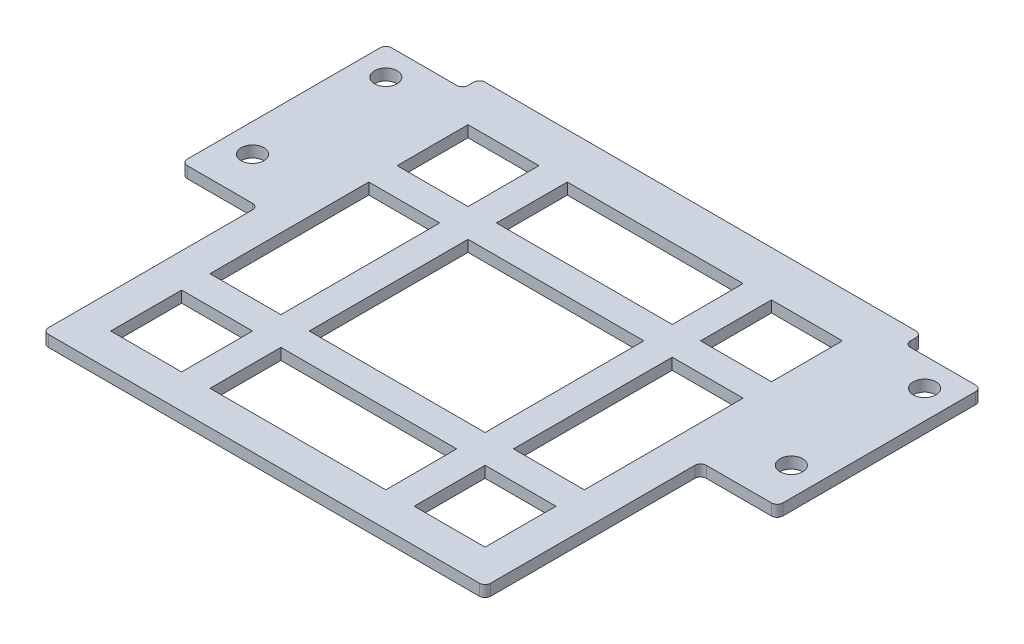
from build123d import *

# Parameters (mm, degrees)
SKETCH_1_R          = 2
EXTRUDE_1_DEPTH     = 2
SKETCH_3_W          = 66
SKETCH_3_H          = 63
CUT_EXTRUDE_1_DEPTH = 94.21614667
FILLET_1_R          = 1
SKETCH_4_W          = 66
SKETCH_4_H          = 5
SKETCH_4_W_2        = 5
SKETCH_4_H_2        = 63
EXTRUDE_1_2_DEPTH   = 2


with BuildPart() as part:
    # 草图1 → Extrude 1 (new body)
    with BuildSketch(Plane(origin=(0, 0, 0), x_dir=(1, 0, 0), z_dir=(0, 1, 0))):
        Polygon((-52.5, -39), (-52.5, -3), (-39, -3), (-39, 0), (39, 0), (39, -3), (52.5, -3), (52.5, -39), (39, -39), (39, -77), (-39, -77), (-39, -39), align=None)
        with Locations(Location((-47.5, -8, 0), (0, 0, 270))):
            Circle(SKETCH_1_R, mode=Mode.SUBTRACT)
        with Locations(Location((-47.5, -31.5, 0), (0, 0, 270))):
            Circle(SKETCH_1_R, mode=Mode.SUBTRACT)
        with Locations(Location((47.5, -31.5, 0), (0, 0, 90))):
            Circle(SKETCH_1_R, mode=Mode.SUBTRACT)
        with Locations(Location((47.5, -8, 0), (0, 0, 90))):
            Circle(SKETCH_1_R, mode=Mode.SUBTRACT)
    extrude(amount=EXTRUDE_1_DEPTH)

    # 草图3 → 切除-拉伸1 (cut, through all)
    with BuildSketch(Plane(origin=(0, 2, 0), x_dir=(1, 0, 0), z_dir=(0, 1, 0))):
        with Locations((0, -39.5)):
            Rectangle(SKETCH_3_W, SKETCH_3_H)
    extrude(amount=-CUT_EXTRUDE_1_DEPTH, mode=Mode.SUBTRACT)

    # 圆角1
    fillet_1_edges = [part.edges().sort_by_distance(p)[0] for p in [
        (-52.5, 1, 39),
        (-52.5, 1, 3),
        (-39, 1, 3),
        (-39, 1, 0),
        (39, 1, 0),
        (39, 1, 3),
        (52.5, 1, 3),
        (52.5, 1, 39),
        (39, 1, 39),
        (39, 1, 77),
        (-39, 1, 77),
        (-39, 1, 39),
    ]]
    fillet(fillet_1_edges, radius=FILLET_1_R)

    # 草图4 → Extrude 1 2 (add)
    with BuildSketch(Plane(origin=(0, 2, 0), x_dir=(1, 0, 0), z_dir=(0, 1, 0))):
        with Locations((0, -23)):
            Rectangle(SKETCH_4_W, SKETCH_4_H)
        with Locations((0, -56)):
            Rectangle(SKETCH_4_W, SKETCH_4_H)
        with Locations((-18, -39.5)):
            Rectangle(SKETCH_4_W_2, SKETCH_4_H_2)
        with Locations((18, -39.5)):
            Rectangle(SKETCH_4_W_2, SKETCH_4_H_2)
    extrude(amount=-EXTRUDE_1_2_DEPTH)


solid = part.part
